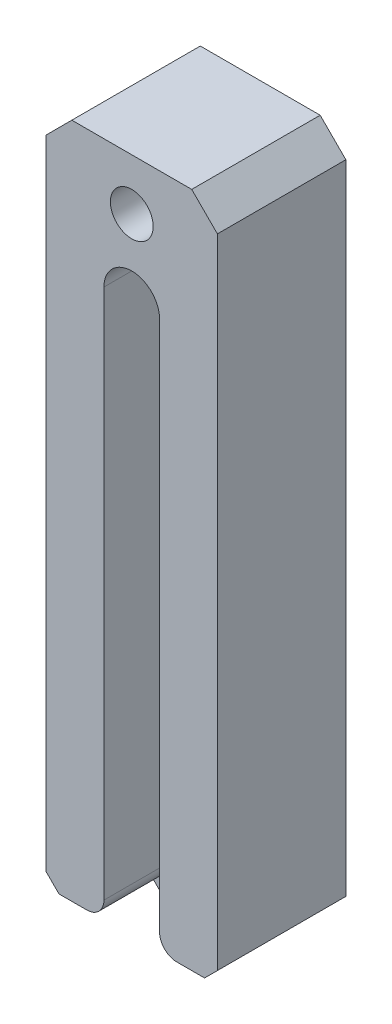
from build123d import *

# Parameters (mm, degrees)
ESQUISSE1_W             = 20
ESQUISSE1_H             = 85
BOSS_EXTRU_1_DEPTH      = 15
ESQUISSE2_R             = 2.5
ENL_V_MAT_EXTRU_1_DEPTH = 15
ESQUISSE3_W             = 20
ESQUISSE3_H             = 6
ENL_V_MAT_EXTRU_2_DEPTH = 9
ENL_V_MAT_EXTRU_3_DEPTH = 15
ESQUISSE7_W             = 6.5
ESQUISSE7_H             = 8
ENL_V_MAT_EXTRU_4_DEPTH = 9
CONG_1_R                = 2
CHANFREIN1_SIZE         = 3


with BuildPart() as part:
    # Esquisse1 → Boss.-Extru.1 (new body)
    with BuildSketch(Plane.XY):
        with Locations((10, 42.5)):
            Rectangle(ESQUISSE1_W, ESQUISSE1_H)
    extrude(amount=BOSS_EXTRU_1_DEPTH)

    # Esquisse2 → Enlèv. mat.-Extru.1 (cut)
    with BuildSketch(Plane.XY.offset(15)):
        with Locations((10, 79)):
            Circle(ESQUISSE2_R)
        with BuildLine():
            Line((6.75, 12), (6.75, 70))
            ThreePointArc((6.75, 70), (10, 73.25), (13.25, 70))
            Line((13.25, 70), (13.25, 12))
            ThreePointArc((13.25, 12), (10, 8.75), (6.75, 12))
        make_face()
    extrude(amount=-ENL_V_MAT_EXTRU_1_DEPTH, mode=Mode.SUBTRACT)

    # Esquisse3 → Enlèv. mat.-Extru.2 (cut)
    with BuildSketch(Plane.XY.offset(15)):
        with Locations((10, 3)):
            Rectangle(ESQUISSE3_W, ESQUISSE3_H)
    extrude(amount=-ENL_V_MAT_EXTRU_2_DEPTH, mode=Mode.SUBTRACT)

    # Esquisse6 → Enlèv. mat.-Extru.3 (cut)
    with BuildSketch(Plane.XY.offset(15)):
        Polygon((7.5, 0), (0, 7.5), (0, -7.5), (20, -7.5), (20, 7.5), (12.5, 0), align=None)
    extrude(amount=-ENL_V_MAT_EXTRU_3_DEPTH, mode=Mode.SUBTRACT)

    # Esquisse7 → Enlèv. mat.-Extru.4 (cut)
    with BuildSketch(Plane.XY.offset(15)):
        with Locations((10, 10)):
            Rectangle(ESQUISSE7_W, ESQUISSE7_H)
    extrude(amount=-ENL_V_MAT_EXTRU_4_DEPTH, mode=Mode.SUBTRACT)

    # Congé1
    cong_1_edges = [part.edges().sort_by_distance(p)[0] for p in [
        (6.75, 6, 10.5),
        (13.25, 6, 10.5),
    ]]
    fillet(cong_1_edges, radius=CONG_1_R)

    # Chanfrein1
    chanfrein1_edges = [part.edges().sort_by_distance(p)[0] for p in [
        (0, 85, 7.5),
        (20, 85, 7.5),
    ]]
    chamfer(chanfrein1_edges, length=CHANFREIN1_SIZE)


solid = part.part
